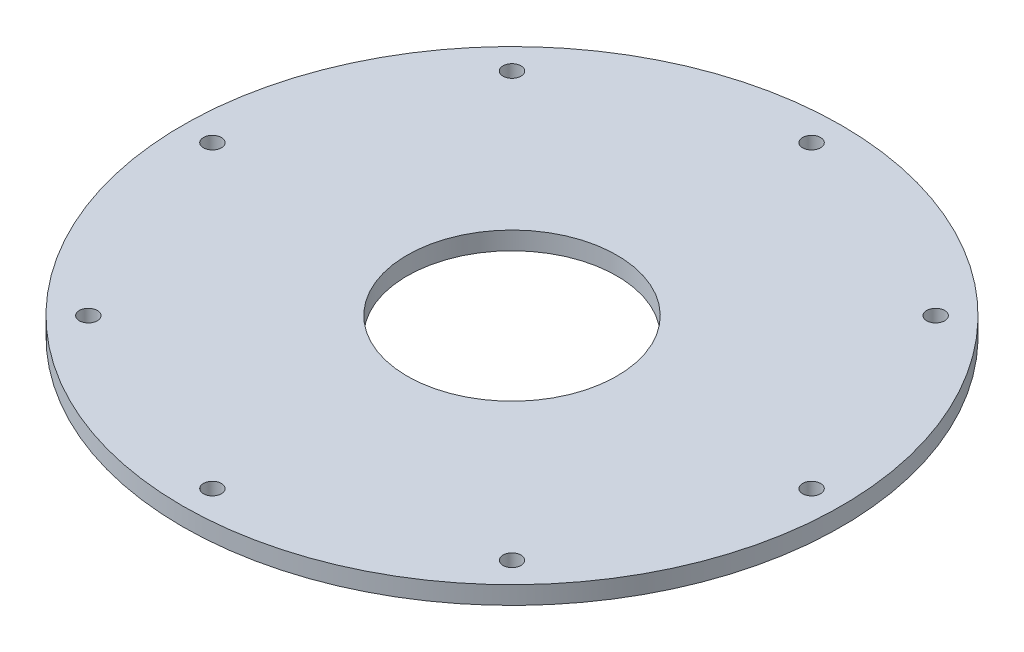
from build123d import *

# Parameters (mm, degrees)
SKETCH1_R           = 55
BOSS_EXTRUDE1_DEPTH = 3
SKETCH2_R           = 17.5
CUT_EXTRUDE1_DEPTH  = 3
SKETCH4_R           = 1.5
CUT_EXTRUDE2_DEPTH  = 3
CIRPATTERN1_COUNT   = 8


with BuildPart() as part:
    # Sketch1 → Boss-Extrude1 (new body)
    with BuildSketch(Plane(origin=(0, 0, 0), x_dir=(1, 0, 0), z_dir=(0, 1, 0))):
        with Locations(Location((0, 0, 0), (0, 0, 270))):
            Circle(SKETCH1_R)
    extrude(amount=BOSS_EXTRUDE1_DEPTH)

    # Sketch2 → Cut-Extrude1 (cut)
    with BuildSketch(Plane(origin=(0, 3, 0), x_dir=(1, 0, 0), z_dir=(0, 1, 0))):
        with Locations(Location((0, 0, 0), (0, 0, 270))):
            Circle(SKETCH2_R)
    extrude(amount=-CUT_EXTRUDE1_DEPTH, mode=Mode.SUBTRACT)

    # Sketch4 → Cut-Extrude2 (cut)
    with BuildSketch(Plane(origin=(0, 3, 0), x_dir=(1, 0, 0), z_dir=(0, 1, 0))):
        with Locations(Location((0, 50, 0), (0, 0, 270))):
            Circle(SKETCH4_R)
    cut_extrude2 = extrude(amount=-CUT_EXTRUDE2_DEPTH, mode=Mode.SUBTRACT)

    # CirPattern1: Cut-Extrude2 ×8 about axis
    cirpattern1_axis = Axis((0, 0, 0), (0, 1, 0))
    for i in range(1, CIRPATTERN1_COUNT):
        add(cut_extrude2.rotate(cirpattern1_axis, i * 360 / CIRPATTERN1_COUNT), mode=Mode.SUBTRACT)


solid = part.part
